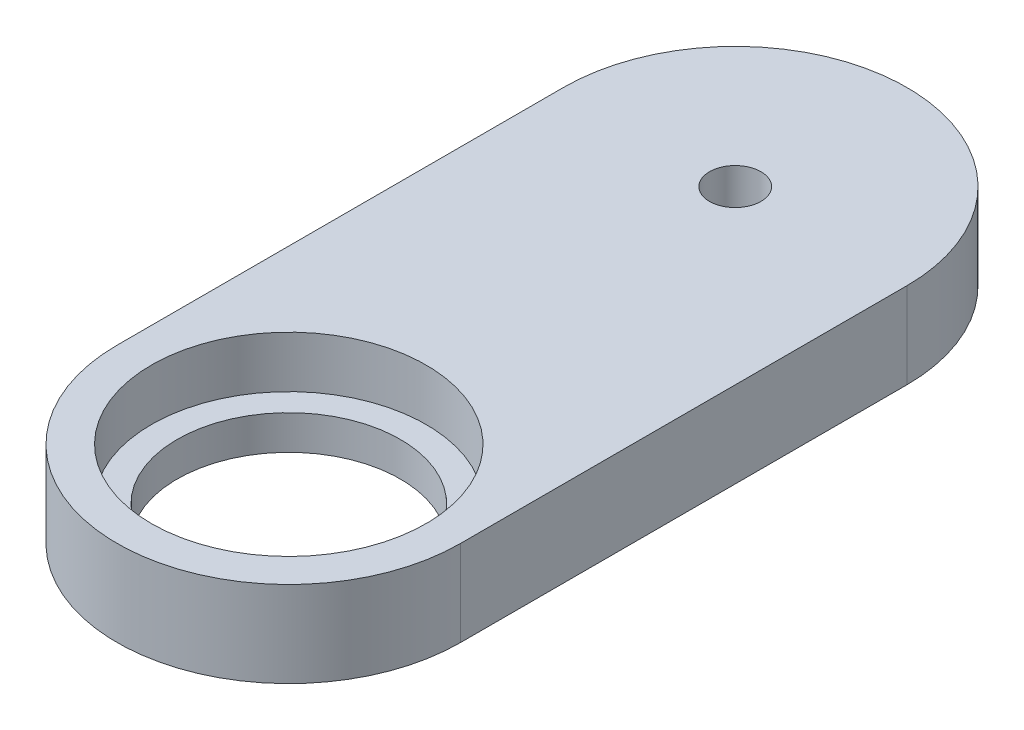
from build123d import *

# Parameters (mm, degrees)
SKETCH_2_R          = 1.5
SKETCH_2_R_2        = 6.5
EXTRUDE_1_DEPTH     = 5
SKETCH_3_R          = 8
CUT_EXTRUDE_1_DEPTH = 3


with BuildPart() as part:
    # Эскиз2 → Бобышка-Вытянуть1 (new body)
    with BuildSketch(Plane(origin=(0, 0, 0), x_dir=(1, 0, 0), z_dir=(0, 1, 0))):
        with BuildLine():
            Line((0, 0), (0, -26))
            ThreePointArc((0, -26), (10, -36), (20, -26))
            Line((20, -26), (20, 0))
            ThreePointArc((20, 0), (10, 10), (0, 0))
        make_face()
        with Locations(Location((10, 0, 0), (0, 0, 270))):
            Circle(SKETCH_2_R, mode=Mode.SUBTRACT)
        with Locations(Location((10, -26, 0), (0, 0, 270))):
            Circle(SKETCH_2_R_2, mode=Mode.SUBTRACT)
    extrude(amount=EXTRUDE_1_DEPTH)

    # Эскиз3 → Вырез-Вытянуть1 (cut)
    with BuildSketch(Plane(origin=(0, 5, 0), x_dir=(1, 0, 0), z_dir=(0, 1, 0))):
        with Locations(Location((10, -26, 0), (0, 0, 270))):
            Circle(SKETCH_3_R)
    extrude(amount=-CUT_EXTRUDE_1_DEPTH, mode=Mode.SUBTRACT)


solid = part.part
